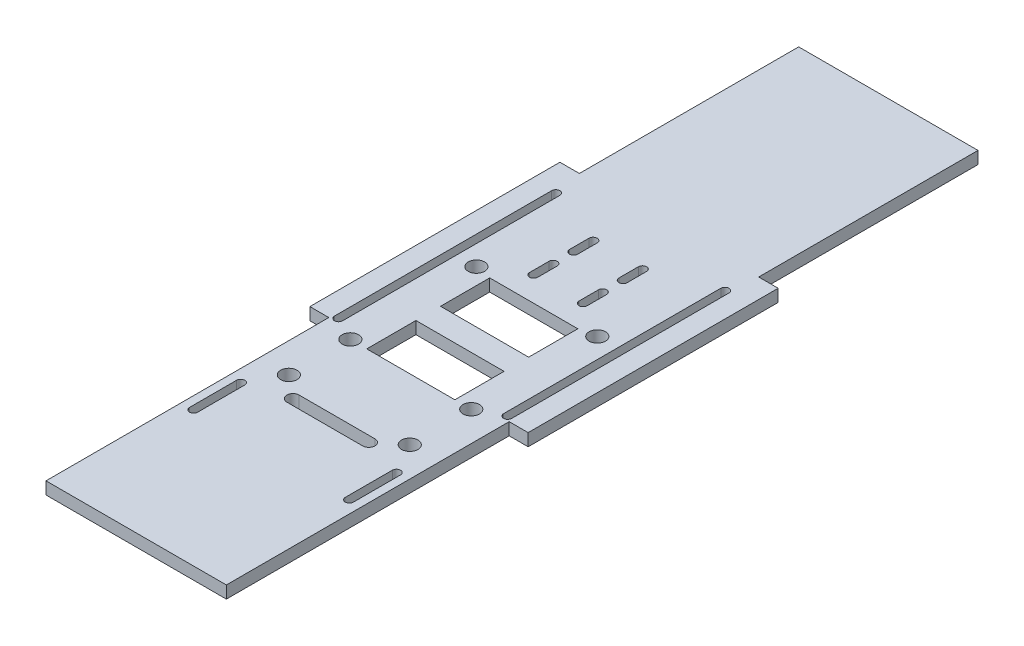
from build123d import *

# Parameters (mm, degrees)
SKETCH1_W           = 17.065625
SKETCH1_H           = 9.525
SKETCH1_R           = 1.5875
BOSS_EXTRUDE2_DEPTH = 1.190625


with BuildPart() as part:
    # Sketch1 → Boss-Extrude2 (new, symmetric)
    with BuildSketch(Plane(origin=(0, 0, 0), x_dir=(1, 0, 0), z_dir=(0, 1, 0))):
        Polygon((48.148623935, -59.93613473), (48.148623935, -5.16738473), (51.819717685, -5.16738473), (51.819717685, 43.25136527), (48.049405185, 43.25136527), (48.049405185, 85.71699027), (13.322842685, 85.71699027), (13.322842685, 43.25136527), (9.552530185, 43.25136527), (9.552530185, -5.16738473), (13.223623935, -5.16738473), (13.223623935, -59.93613473), align=None)
        with Locations((30.686123935, 12.29511527)):
            Rectangle(SKETCH1_W, SKETCH1_H, mode=Mode.SUBTRACT)
        with Locations((30.686123935, -1.99238473)):
            Rectangle(SKETCH1_W, SKETCH1_H, mode=Mode.SUBTRACT)
        with BuildLine():
            Line((16.398623935, -24.61425973), (16.398623935, -33.74238473))
            ThreePointArc((16.398623935, -33.74238473), (15.604873935, -34.53613473), (14.811123935, -33.74238473))
            Line((14.811123935, -33.74238473), (14.811123935, -24.61425973))
            ThreePointArc((14.811123935, -24.61425973), (15.604873935, -23.82050973), (16.398623935, -24.61425973))
        make_face(mode=Mode.SUBTRACT)
        with Locations(Location((18.978311435, -18.66113473, 0), (0, 0, 90))):
            Circle(SKETCH1_R, mode=Mode.SUBTRACT)
        with Locations(Location((18.978311435, -6.75488473, 0), (0, 0, 90))):
            Circle(SKETCH1_R, mode=Mode.SUBTRACT)
        with BuildLine():
            ThreePointArc((23.343936435, -23.42363473), (22.153311435, -22.23300973), (23.343936435, -21.04238473))
            Line((23.343936435, -21.04238473), (38.028311435, -21.04238473))
            ThreePointArc((38.028311435, -21.04238473), (39.218936435, -22.23300973), (38.028311435, -23.42363473))
            Line((38.028311435, -23.42363473), (23.343936435, -23.42363473))
        make_face(mode=Mode.SUBTRACT)
        with BuildLine():
            ThreePointArc((46.561123935, -33.74238473), (45.767373935, -34.53613473), (44.973623935, -33.74238473))
            Line((44.973623935, -33.74238473), (44.973623935, -24.61425973))
            ThreePointArc((44.973623935, -24.61425973), (45.767373935, -23.82050973), (46.561123935, -24.61425973))
            Line((46.561123935, -24.61425973), (46.561123935, -33.74238473))
        make_face(mode=Mode.SUBTRACT)
        with Locations(Location((42.393936435, -18.66113473, 0), (0, 0, 90))):
            Circle(SKETCH1_R, mode=Mode.SUBTRACT)
        with Locations(Location((42.393936435, -6.75488473, 0), (0, 0, 90))):
            Circle(SKETCH1_R, mode=Mode.SUBTRACT)
        with BuildLine():
            ThreePointArc((15.108780185, -4.37363473), (14.315030185, -5.16738473), (13.521280185, -4.37363473))
            Line((13.521280185, -4.37363473), (13.521280185, 37.69511527))
            ThreePointArc((13.521280185, 37.69511527), (14.315030185, 38.48886527), (15.108780185, 37.69511527))
            Line((15.108780185, 37.69511527), (15.108780185, -4.37363473))
        make_face(mode=Mode.SUBTRACT)
        with Locations(Location((18.978311435, 17.65292777, 0), (0, 0, 90))):
            Circle(SKETCH1_R, mode=Mode.SUBTRACT)
        with BuildLine():
            Line((26.696280185, 25.590053861), (26.696280185, 21.82011527))
            ThreePointArc((26.696280185, 21.82011527), (25.902530185, 21.02636527), (25.108780185, 21.82011527))
            Line((25.108780185, 21.82011527), (25.108780185, 25.590053861))
            ThreePointArc((25.108780185, 25.590053861), (25.902530185, 26.383803861), (26.696280185, 25.590053861))
        make_face(mode=Mode.SUBTRACT)
        with BuildLine():
            Line((26.696280185, 33.328742451), (26.696280185, 29.558803861))
            ThreePointArc((26.696280185, 29.558803861), (25.902530185, 28.765053861), (25.108780185, 29.558803861))
            Line((25.108780185, 29.558803861), (25.108780185, 33.328742451))
            ThreePointArc((25.108780185, 33.328742451), (25.902530185, 34.122492451), (26.696280185, 33.328742451))
        make_face(mode=Mode.SUBTRACT)
        with BuildLine():
            ThreePointArc((46.263467685, 37.69511527), (47.057217685, 38.48886527), (47.850967685, 37.69511527))
            Line((47.850967685, 37.69511527), (47.850967685, -4.37363473))
            ThreePointArc((47.850967685, -4.37363473), (47.057217685, -5.16738473), (46.263467685, -4.37363473))
            Line((46.263467685, -4.37363473), (46.263467685, 37.69511527))
        make_face(mode=Mode.SUBTRACT)
        with Locations(Location((42.393936435, 17.65292777, 0), (0, 0, 90))):
            Circle(SKETCH1_R, mode=Mode.SUBTRACT)
        with BuildLine():
            ThreePointArc((36.263467685, 21.82011527), (35.469717685, 21.02636527), (34.675967685, 21.82011527))
            Line((34.675967685, 21.82011527), (34.675967685, 25.590053861))
            ThreePointArc((34.675967685, 25.590053861), (35.469717685, 26.383803861), (36.263467685, 25.590053861))
            Line((36.263467685, 25.590053861), (36.263467685, 21.82011527))
        make_face(mode=Mode.SUBTRACT)
        with BuildLine():
            ThreePointArc((36.263467685, 29.558803861), (35.469717685, 28.765053861), (34.675967685, 29.558803861))
            Line((34.675967685, 29.558803861), (34.675967685, 33.328742451))
            ThreePointArc((34.675967685, 33.328742451), (35.469717685, 34.122492451), (36.263467685, 33.328742451))
            Line((36.263467685, 33.328742451), (36.263467685, 29.558803861))
        make_face(mode=Mode.SUBTRACT)
    extrude(amount=BOSS_EXTRUDE2_DEPTH, both=True)


solid = part.part
